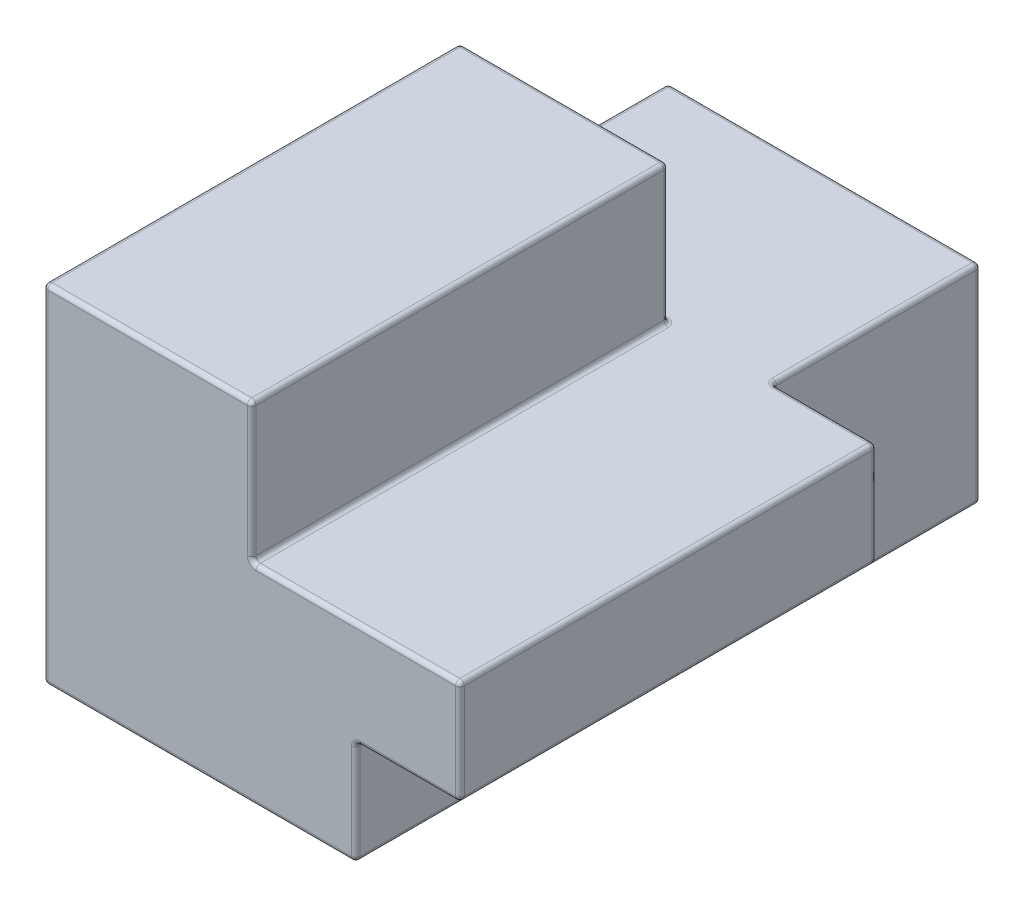
from build123d import *

# Parameters (mm, degrees)
BOSS_EXTRUDE1_DEPTH = 36
SKETCH1_3_W         = 48
SKETCH1_3_H         = 12
BOSS_EXTRUDE2_DEPTH = 48
SKETCH1_4_W         = 48
SKETCH1_4_H         = 16
BOSS_EXTRUDE3_DEPTH = 24
FILLET1_R           = 0.5


with BuildPart() as part:
    # Sketch1 → Boss-Extrude1 (new body)
    with BuildSketch(Plane(origin=(0, 0, 0), x_dir=(0, 0, -1), z_dir=(1, 0, 0))):
        Polygon((-36, 0), (-36, -12), (36, -12), (36, 12), (12, 12), (12, 0), align=None)
    extrude(amount=BOSS_EXTRUDE1_DEPTH)

    # Sketch1<3> → Boss-Extrude2 (add)
    with BuildSketch(Plane(origin=(0, 0, 0), x_dir=(0, 0, -1), z_dir=(1, 0, 0))):
        with Locations((-12, 6)):
            Rectangle(SKETCH1_3_W, SKETCH1_3_H)
    extrude(amount=BOSS_EXTRUDE2_DEPTH)

    # Sketch1<4> → Boss-Extrude3 (add)
    with BuildSketch(Plane(origin=(0, 0, 0), x_dir=(0, 0, -1), z_dir=(1, 0, 0))):
        with Locations((-12, 20)):
            Rectangle(SKETCH1_4_W, SKETCH1_4_H)
    extrude(amount=BOSS_EXTRUDE3_DEPTH)

    # Fillet1
    fillet1_edges = [part.edges().sort_by_distance(p)[0] for p in [
        (18, -12, 36),
        (18, -12, -36),
        (18, 12, -36),
        (36, 12, -24),
        (36, 0, -36),
        (36, -12, 0),
        (36, -6, 36),
        (36, 0, 12),
        (36, 6, -12),
        (0, 12, -24),
        (0, 0, -36),
        (0, -12, 0),
        (0, 8, 36),
        (42, 0, -12),
        (42, 12, -12),
        (36, 12, 36),
        (42, 0, 36),
        (48, 6, 36),
        (48, 12, 12),
        (48, 6, -12),
        (48, 0, 12),
        (12, 12, -12),
        (12, 28, -12),
        (12, 28, 36),
        (24, 20, 36),
        (24, 28, 12),
        (24, 20, -12),
        (24, 12, 12),
        (0, 28, 12),
        (0, 20, -12),
    ]]
    fillet(fillet1_edges, radius=FILLET1_R)


solid = part.part
